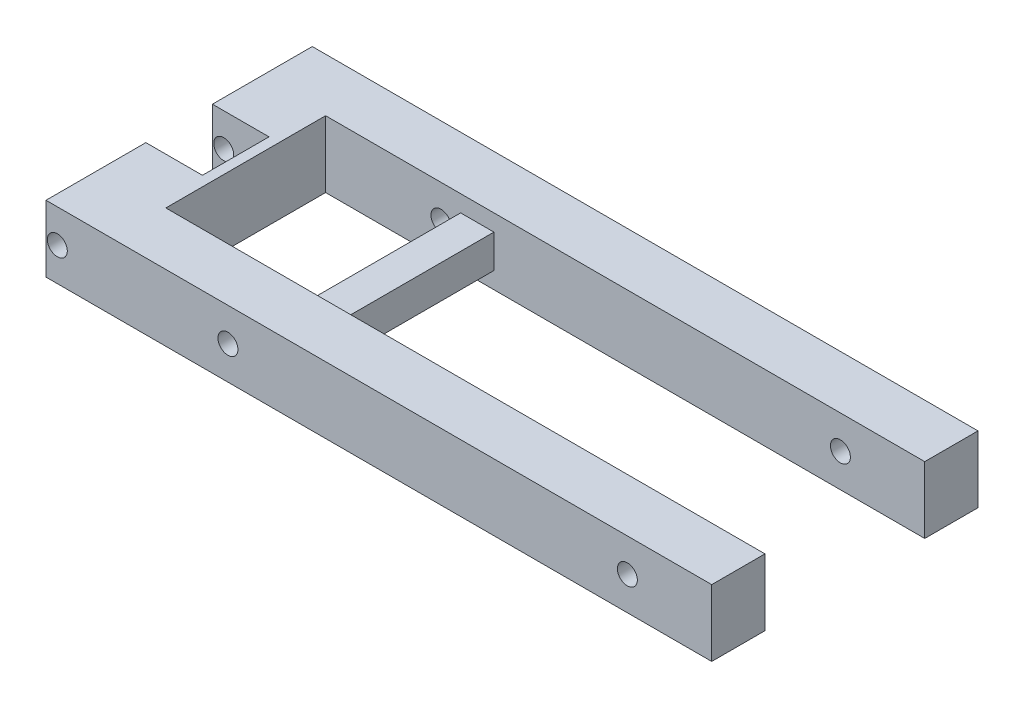
from build123d import *

# Parameters (mm, degrees)
ESTRUSIONE_ESTRUSIONE1_DEPTH             = 100
TAGLIO_ESTRUSIONE5_DEPTH                 = 704.628710974
TAGLIO_ESTRUSIONE5_DEPTH_BACK            = 704.628710974
SCHIZZO2_R                               = 15
TAGLIO_ESTRUSIONE6_DEPTH                 = 704.628710974
TAGLIO_ESTRUSIONE6_DEPTH_BACK            = 704.628710974
SCHIZZO3_W                               = 85
SCHIZZO3_H                               = 100
ESTRUSIONE_ESTRUSIONE2_REACH             = 705.629
SCHIZZO4_W                               = 50
SCHIZZO4_H                               = 50
ESTRUSIONE_ESTRUSIONE2_DIRECTION_2_REACH = 705.629


with BuildPart() as part:
    # Schizzo1 → Estrusione-Estrusione1 (new body)
    with BuildSketch(Plane(origin=(0, 0, 0), x_dir=(1, 0, 0), z_dir=(0, 1, 0))):
        Polygon((-332.846822006, -200), (-332.846822006, 200), (667.153177994, 200), (667.153177994, 120), (-232.846822006, 120), (-232.846822006, -120), (667.153177994, -120), (667.153177994, -200), align=None)
    extrude(amount=ESTRUSIONE_ESTRUSIONE1_DEPTH)

    # Schizzo2 → Taglio-Estrusione5 (cut, two sides: drawn at the far end of the back side and taken through both)
    with BuildSketch(Plane.XY.offset(-TAGLIO_ESTRUSIONE5_DEPTH_BACK)):
        with Locations((-315.846822006, 50)):
            Circle(SCHIZZO2_R)
        with Locations((-59.546822006, 50)):
            Circle(SCHIZZO2_R)
        with Locations((540.453177994, 50)):
            Circle(SCHIZZO2_R)
    extrude(amount=TAGLIO_ESTRUSIONE5_DEPTH + TAGLIO_ESTRUSIONE5_DEPTH_BACK, mode=Mode.SUBTRACT)

    # Schizzo3 → Taglio-Estrusione6 (cut, two sides: drawn at the far end of the back side and taken through both)
    with BuildSketch(Plane(origin=(0, 0, 0), x_dir=(1, 0, 0), z_dir=(0, 1, 0)).offset(-TAGLIO_ESTRUSIONE6_DEPTH_BACK)):
        with Locations((-290.346822006, 0)):
            Rectangle(SCHIZZO3_W, SCHIZZO3_H)
    extrude(amount=TAGLIO_ESTRUSIONE6_DEPTH + TAGLIO_ESTRUSIONE6_DEPTH_BACK, mode=Mode.SUBTRACT)

    # Schizzo4 → Estrusione-Estrusione2 (add, up to next)
    with BuildSketch(Plane.XY, mode=Mode.PRIVATE) as estrusione_estrusione2_sk1:
        with Locations((-5, 50)):
            Rectangle(SCHIZZO4_W, SCHIZZO4_H)
    estrusione_estrusione2_tool1 = extrude(estrusione_estrusione2_sk1.sketch, amount=ESTRUSIONE_ESTRUSIONE2_REACH, mode=Mode.PRIVATE) - part.part
    add(estrusione_estrusione2_tool1.solids().sort_by_distance((-5, 50, 0))[0])

    # Schizzo4 → Estrusione-Estrusione2 direction 2 (add, up to next)
    with BuildSketch(Plane.XY, mode=Mode.PRIVATE) as estrusione_estrusione2_direction_2_sk1:
        with Locations((-5, 50)):
            Rectangle(SCHIZZO4_W, SCHIZZO4_H)
    estrusione_estrusione2_direction_2_tool1 = extrude(estrusione_estrusione2_direction_2_sk1.sketch, amount=-ESTRUSIONE_ESTRUSIONE2_DIRECTION_2_REACH, mode=Mode.PRIVATE) - part.part
    add(estrusione_estrusione2_direction_2_tool1.solids().sort_by_distance((-5, 50, 0))[0])


solid = part.part
